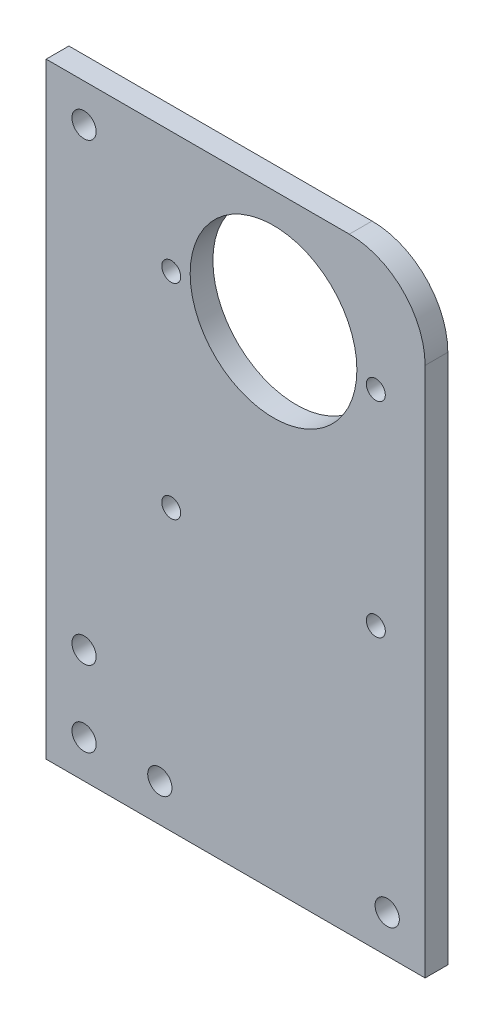
from build123d import *

# Parameters (mm, degrees)
SKETCH_1_W          = 50
SKETCH_1_H          = 80
EXTRUDE_1_DEPTH     = 3
SKETCH_2_R          = 11
SKETCH_2_R_2        = 1.25
SKETCH_2_R_3        = 1.6
CUT_EXTRUDE_1_DEPTH = 48.265209192
FILLET_1_R          = 10


with BuildPart() as part:
    # ｽｹｯﾁ1 → ﾎﾞｽ - 押し出し1 (new body)
    with BuildSketch(Plane.XY):
        Rectangle(SKETCH_1_W, SKETCH_1_H)
    extrude(amount=EXTRUDE_1_DEPTH)

    # ｽｹｯﾁ2 → ｶｯﾄ - 押し出し1 (cut, through all)
    with BuildSketch(Plane.XY.offset(3)):
        with Locations((5, 25)):
            Circle(SKETCH_2_R)
        with Locations((18.5, 24)):
            Circle(SKETCH_2_R_2)
        with Locations((-20, 35)):
            Circle(SKETCH_2_R_3)
        with Locations((-20, -25)):
            Circle(SKETCH_2_R_3)
        with Locations((-8.5, 24)):
            Circle(SKETCH_2_R_2)
        with Locations((18.5, -3)):
            Circle(SKETCH_2_R_2)
        with Locations((-20, -35)):
            Circle(SKETCH_2_R_3)
        with Locations((-10, -35)):
            Circle(SKETCH_2_R_3)
        with Locations((20, -35)):
            Circle(SKETCH_2_R_3)
        with Locations((-8.5, -3)):
            Circle(SKETCH_2_R_2)
    extrude(amount=-CUT_EXTRUDE_1_DEPTH, mode=Mode.SUBTRACT)

    # ﾌｨﾚｯﾄ1
    fillet_1_edges = [part.edges().sort_by_distance(p)[0] for p in [
        (25, 40, 1.5),
    ]]
    fillet(fillet_1_edges, radius=FILLET_1_R)


solid = part.part
